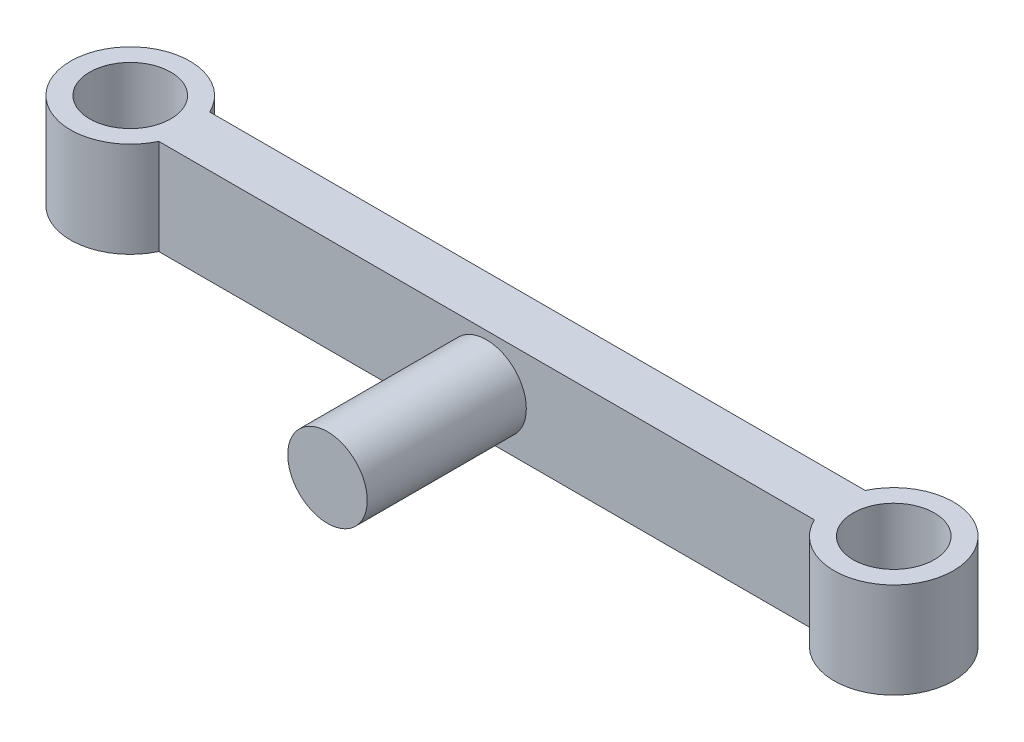
from build123d import *

# Parameters (mm, degrees)
SKETCH1_R                            = 9.375
SKETCH1_R_2                          = 6.375
BOSS_EXTRUDE1_DEPTH                  = 7.5
BOSS_EXTRUDE1_2_DEPTH                = 7.5
BOSS_EXTRUDE2_REACH                  = 72.406
BOSS_EXTRUDE2_END_RADIUS             = 9.375
SKETCH2_W                            = 8
SKETCH2_H                            = 15
BOSS_EXTRUDE2_DIRECTION_2_REACH      = 72.406
BOSS_EXTRUDE2_DIRECTION_2_END_RADIUS = 9.375
SKETCH4_R                            = 6.25
BOSS_EXTRUDE3_DEPTH                  = 25
CUT_EXTRUDE1_REACH                   = 77.565
CUT_EXTRUDE1_END_RADIUS              = 6.25
SKETCH5_W                            = 8
SKETCH5_H                            = 3
CUT_EXTRUDE1_DIRECTION_2_REACH       = 77.565
CUT_EXTRUDE1_DIRECTION_2_END_RADIUS  = 6.25


with BuildPart() as part:
    # Sketch1 → Boss-Extrude1 (new, symmetric)
    with BuildSketch(Plane(origin=(0, 0, 0), x_dir=(1, 0, 0), z_dir=(0, 1, 0))):
        with Locations(Location((-60, 0, 0), (0, 0, 90))):
            Circle(SKETCH1_R)
        with Locations(Location((-60, 0, 0), (0, 0, 90))):
            Circle(SKETCH1_R_2, mode=Mode.SUBTRACT)
    extrude(amount=BOSS_EXTRUDE1_DEPTH, both=True)



with BuildPart() as body_2:
    # Sketch1 → Boss-Extrude1 2 (new, symmetric)
    with BuildSketch(Plane(origin=(0, 0, 0), x_dir=(1, 0, 0), z_dir=(0, 1, 0))):
        with Locations(Location((60, 0, 0), (0, 0, 270))):
            Circle(SKETCH1_R)
        with Locations(Location((60, 0, 0), (0, 0, 270))):
            Circle(SKETCH1_R_2, mode=Mode.SUBTRACT)
    extrude(amount=BOSS_EXTRUDE1_2_DEPTH, both=True)


with BuildPart() as part_1:
    add(part.part)

    add(body_2.part)  # Boss-Extrude2 merges body 2
    # Boss-Extrude2: up to this cylinder (the profile starts outside it)
    boss_extrude2_end = Plane(origin=(60, 0, 0), z_dir=(0, -1, 0)) * Cylinder(BOSS_EXTRUDE2_END_RADIUS, 164.562, mode=Mode.PRIVATE)
    # Sketch2 → Boss-Extrude2 (add, up to the surface)
    with BuildSketch(Plane(origin=(0, 0, 0), x_dir=(0, 0, -1), z_dir=(1, 0, 0)), mode=Mode.PRIVATE) as boss_extrude2_sk1:
        Rectangle(SKETCH2_W, SKETCH2_H)
    boss_extrude2_tool1 = extrude(boss_extrude2_sk1.sketch, amount=BOSS_EXTRUDE2_REACH, mode=Mode.PRIVATE) - boss_extrude2_end
    add(boss_extrude2_tool1.solids().sort_by_distance((0, 0, 0))[0])

    # Boss-Extrude2 direction 2: up to this cylinder (the profile starts outside it)
    boss_extrude2_direction_2_end = Plane(origin=(-60, 0, 0), z_dir=(0, -1, 0)) * Cylinder(BOSS_EXTRUDE2_DIRECTION_2_END_RADIUS, 164.562, mode=Mode.PRIVATE)
    # Sketch2 → Boss-Extrude2 direction 2 (add, up to the surface)
    with BuildSketch(Plane(origin=(0, 0, 0), x_dir=(0, 0, -1), z_dir=(1, 0, 0)), mode=Mode.PRIVATE) as boss_extrude2_direction_2_sk1:
        Rectangle(SKETCH2_W, SKETCH2_H)
    boss_extrude2_direction_2_tool1 = extrude(boss_extrude2_direction_2_sk1.sketch, amount=-BOSS_EXTRUDE2_DIRECTION_2_REACH, mode=Mode.PRIVATE) - boss_extrude2_direction_2_end
    add(boss_extrude2_direction_2_tool1.solids().sort_by_distance((0, 0, 0))[0])

    # Sketch4 → Boss-Extrude3 (add)
    with BuildSketch(Plane.XY.offset(4)):
        Circle(SKETCH4_R)
    extrude(amount=BOSS_EXTRUDE3_DEPTH)

    # Cut-Extrude1: up to this cylinder (the profile starts inside it)
    cut_extrude1_end = Plane(origin=(0, 0, 22), z_dir=(0, 0, -1)) * Cylinder(CUT_EXTRUDE1_END_RADIUS, 168.63, mode=Mode.PRIVATE)
    # Sketch5 → Cut-Extrude1 (cut, up to the surface)
    with BuildSketch(Plane(origin=(0, 0, 0), x_dir=(0, 0, -1), z_dir=(1, 0, 0)), mode=Mode.PRIVATE) as cut_extrude1_sk1:
        with Locations((-22, -6)):
            Rectangle(SKETCH5_W, SKETCH5_H)
    cut_extrude1_tool1 = extrude(cut_extrude1_sk1.sketch, amount=-CUT_EXTRUDE1_REACH, mode=Mode.PRIVATE) & cut_extrude1_end
    add(cut_extrude1_tool1.solids().sort_by_distance((0, -6, 22))[0], mode=Mode.SUBTRACT)

    # Cut-Extrude1 direction 2: up to this cylinder (the profile starts inside it)
    cut_extrude1_direction_2_end = Plane(origin=(0, 0, 22), z_dir=(0, 0, -1)) * Cylinder(CUT_EXTRUDE1_DIRECTION_2_END_RADIUS, 168.63, mode=Mode.PRIVATE)
    # Sketch5 → Cut-Extrude1 direction 2 (cut, up to the surface)
    with BuildSketch(Plane(origin=(0, 0, 0), x_dir=(0, 0, -1), z_dir=(1, 0, 0)), mode=Mode.PRIVATE) as cut_extrude1_direction_2_sk1:
        with Locations((-22, -6)):
            Rectangle(SKETCH5_W, SKETCH5_H)
    cut_extrude1_direction_2_tool1 = extrude(cut_extrude1_direction_2_sk1.sketch, amount=CUT_EXTRUDE1_DIRECTION_2_REACH, mode=Mode.PRIVATE) & cut_extrude1_direction_2_end
    add(cut_extrude1_direction_2_tool1.solids().sort_by_distance((0, -6, 22))[0], mode=Mode.SUBTRACT)


solid = part_1.part
